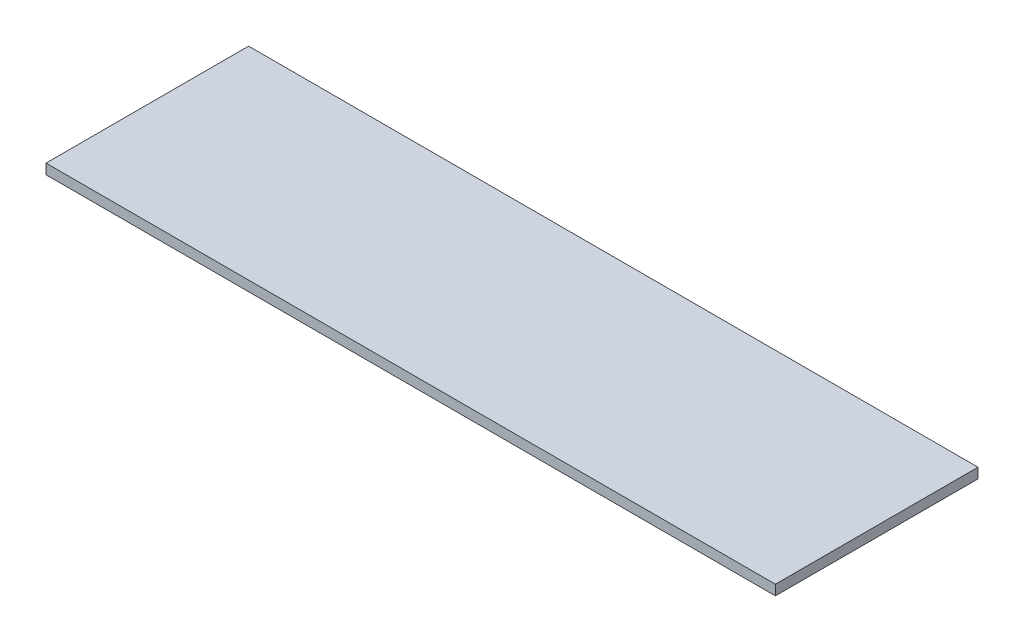
from build123d import *

# Parameters (mm, degrees)
CROQUIS1_W              = 720
CROQUIS1_H              = 200
SALIENTE_EXTRUIR1_DEPTH = 10


with BuildPart() as part:
    # Croquis1 → Saliente-Extruir1 (new body)
    with BuildSketch(Plane(origin=(0, 0, 0), x_dir=(1, 0, 0), z_dir=(0, 1, 0))):
        Rectangle(CROQUIS1_W, CROQUIS1_H)
    extrude(amount=SALIENTE_EXTRUIR1_DEPTH)


solid = part.part
